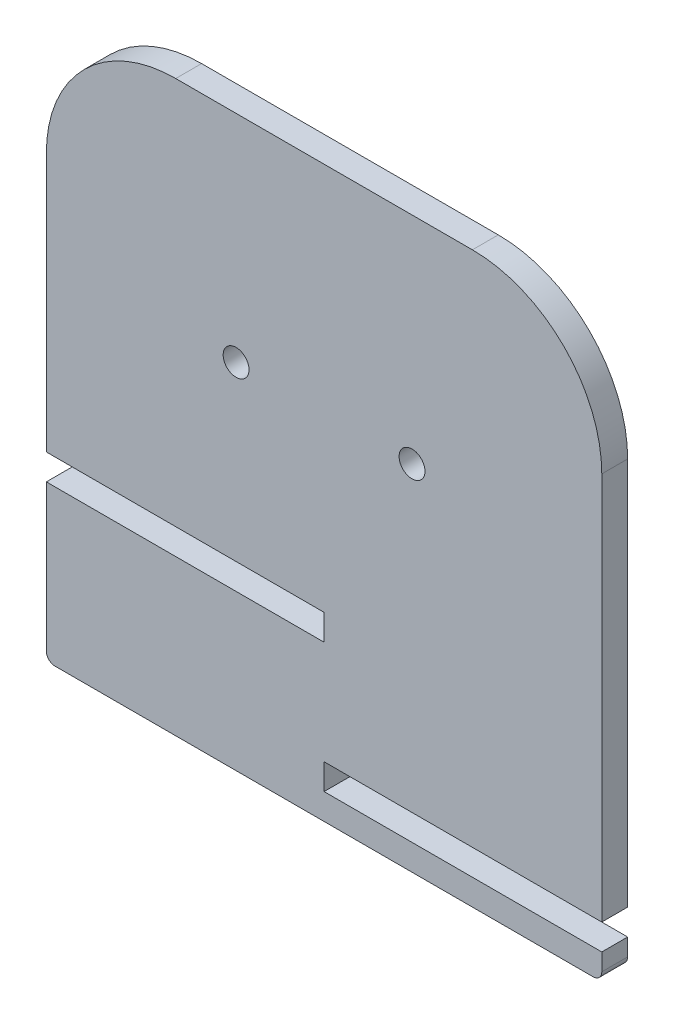
from build123d import *

# Parameters (mm, degrees)
BOSS_EXTRUDE7_DEPTH = 3
SKETCH3_R           = 1.5
CUT_EXTRUDE1_DEPTH  = 3


with BuildPart() as part:
    # Sketch1 → Boss-Extrude7 (new body)
    with BuildSketch(Plane.XY):
        with BuildLine():
            Line((-12.261503554, -6.485084804), (-46.661503554, -6.485084804))
            ThreePointArc((-46.661503554, -6.485084804), (-57.268105272, -10.878483086), (-61.661503554, -21.485084804))
            Line((-61.661503554, -21.485084804), (-61.661503554, -51.485084804))
            Line((-61.661503554, -51.485084804), (-29.461503554, -51.485084804))
            Line((-29.461503554, -51.485084804), (-29.461503554, -54.485084804))
            Line((-29.461503554, -54.485084804), (-61.661503554, -54.485084804))
            Line((-61.661503554, -54.485084804), (-61.661503554, -71.485084804))
            ThreePointArc((-61.661503554, -71.485084804), (-61.368610335, -72.192191585), (-60.661503554, -72.485084804))
            Line((-60.661503554, -72.485084804), (1.738496446, -72.485084804))
            ThreePointArc((1.738496446, -72.485084804), (2.445603227, -72.192191585), (2.738496446, -71.485084804))
            Line((2.738496446, -71.485084804), (2.738496446, -69.485084804))
            Line((2.738496446, -69.485084804), (-29.461503554, -69.485084804))
            Line((-29.461503554, -69.485084804), (-29.461503554, -66.485084804))
            Line((-29.461503554, -66.485084804), (2.738496446, -66.485084804))
            Line((2.738496446, -66.485084804), (2.738496446, -21.485084804))
            ThreePointArc((2.738496446, -21.485084804), (-1.654901836, -10.878483086), (-12.261503554, -6.485084804))
        make_face()
    extrude(amount=BOSS_EXTRUDE7_DEPTH)

    # Sketch3 → Cut-Extrude1 (cut)
    with BuildSketch(Plane.XY.offset(3)):
        with Locations((-19.261503554, -31.485084804)):
            Circle(SKETCH3_R)
        with Locations((-39.661503554, -31.485084804)):
            Circle(SKETCH3_R)
    extrude(amount=-CUT_EXTRUDE1_DEPTH, mode=Mode.SUBTRACT)


solid = part.part
